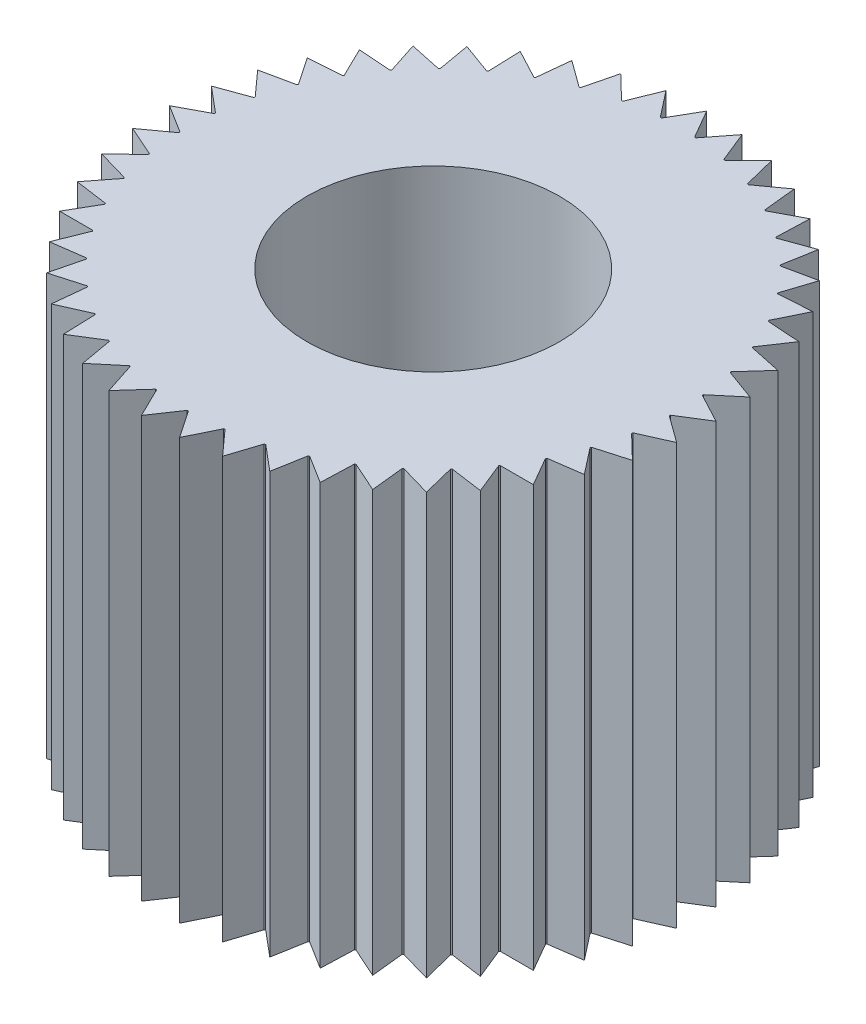
from build123d import *

# Parameters (mm, degrees)
BOSS_EXTRUDE1_DEPTH = 3.81
SKETCH4_R           = 1.143
CUT_EXTRUDE2_DEPTH  = 2.286
SKETCH5_R           = 0.635
CUT_EXTRUDE3_DEPTH  = 1.27
SCALE1_SCALE        = 1.5


with BuildPart() as part:
    # Sketch2 → Boss-Extrude1 (new body)
    with BuildSketch(Plane(origin=(0, 0, 0), x_dir=(1, 0, 0), z_dir=(0, 1, 0))):
        with BuildLine():
            Line((0.344662185, 2.452398872), (0.160511142, 2.216696286))
            ThreePointArc((0.160511142, 2.216696286), (0.155033763, 2.217086102), (0.149555438, 2.217462383))
            Line((0.149555438, 2.217462383), (0, 2.4765))
            Line((0, 2.4765), (-0.149555438, 2.217462383))
            ThreePointArc((-0.149555438, 2.217462383), (-0.155033763, 2.217086102), (-0.160511142, 2.216696286))
            Line((-0.160511142, 2.216696286), (-0.344662185, 2.452398872))
            Line((-0.344662185, 2.452398872), (-0.456711091, 2.175068098))
            ThreePointArc((-0.456711091, 2.175068098), (-0.462083733, 2.173933043), (-0.467453554, 2.172784717))
            Line((-0.467453554, 2.172784717), (-0.682615912, 2.38056459))
            Line((-0.682615912, 2.38056459), (-0.754977382, 2.090338586))
            ThreePointArc((-0.754977382, 2.090338586), (-0.760139769, 2.08846685), (-0.765297515, 2.086582364))
            Line((-0.765297515, 2.086582364), (-1.007283297, 2.262395326))
            Line((-1.007283297, 2.262395326), (-1.038548897, 1.964923011))
            ThreePointArc((-1.038548897, 1.964923011), (-1.043400548, 1.962351025), (-1.04824583, 1.95976706))
            Line((-1.04824583, 1.95976706), (-1.312345058, 2.10019111))
            Line((-1.312345058, 2.10019111), (-1.301906239, 1.801262445))
            ThreePointArc((-1.301906239, 1.801262445), (-1.306352723, 1.79804027), (-1.310791233, 1.794807119))
            Line((-1.310791233, 1.794807119), (-1.591863515, 1.897109063))
            Line((-1.591863515, 1.897109063), (-1.539923457, 1.602542354))
            ThreePointArc((-1.539923457, 1.602542354), (-1.543878228, 1.598732706), (-1.547823575, 1.594913299))
            Line((-1.547823575, 1.594913299), (-1.84039816, 1.657101947))
            Line((-1.84039816, 1.657101947), (-1.747967817, 1.372630599))
            ThreePointArc((-1.747967817, 1.372630599), (-1.7513539, 1.368307629), (-1.754729292, 1.363976306))
            Line((-1.754729292, 1.363976306), (-2.053111548, 1.384841225))
            Line((-2.053111548, 1.384841225), (-1.921989971, 1.116002151))
            ThreePointArc((-1.921989971, 1.116002151), (-1.92474146, 1.11125), (-1.927481199, 1.106491065))
            Line((-1.927481199, 1.106491065), (-2.225863456, 1.085626145))
            Line((-2.225863456, 1.085626145), (-2.058602777, 0.837651991))
            ThreePointArc((-2.058602777, 0.837651991), (-2.060666117, 0.832563154), (-2.062716877, 0.827469234))
            Line((-2.062716877, 0.827469234), (-2.355291463, 0.765280587))
            Line((-2.355291463, 0.765280587), (-2.155147221, 0.542997887))
            ThreePointArc((-2.155147221, 0.542997887), (-2.156482252, 0.537671413), (-2.157804118, 0.532341657))
            Line((-2.157804118, 0.532341657), (-2.4388764, 0.430039712))
            Line((-2.4388764, 0.430039712), (-2.209744176, 0.237774947))
            ThreePointArc((-2.209744176, 0.237774947), (-2.210324912, 0.23231451), (-2.210892156, 0.226852654))
            Line((-2.210892156, 0.226852654), (-2.474991383, 0.086428604))
            Line((-2.474991383, 0.086428604), (-2.221330975, -0.072076012))
            ThreePointArc((-2.221330975, -0.072076012), (-2.221146113, -0.077564131), (-2.220947692, -0.083051778))
            Line((-2.220947692, -0.083051778), (-2.462933474, -0.258864739))
            Line((-2.462933474, -0.258864739), (-2.189682092, -0.380524093))
            ThreePointArc((-2.189682092, -0.380524093), (-2.188735231, -0.385933075), (-2.187775009, -0.391339701))
            Line((-2.187775009, -0.391339701), (-2.402937366, -0.599119574))
            Line((-2.402937366, -0.599119574), (-2.115413539, -0.681565705))
            ThreePointArc((-2.115413539, -0.681565705), (-2.113723107, -0.68679027), (-2.112019773, -0.692010642))
            Line((-2.112019773, -0.692010642), (-2.296170816, -0.927713229))
            Line((-2.296170816, -0.927713229), (-1.999970867, -0.969341417))
            ThreePointArc((-1.999970867, -0.969341417), (-1.997569768, -0.974279874), (-1.995156475, -0.979212383))
            Line((-1.995156475, -0.979212383), (-2.144711912, -1.23825))
            Line((-2.144711912, -1.23825), (-1.845601037, -1.23825))
            ThreePointArc((-1.845601037, -1.23825), (-1.842536005, -1.242806228), (-1.839459725, -1.247354869))
            Line((-1.839459725, -1.247354869), (-1.951508631, -1.524685644))
            Line((-1.951508631, -1.524685644), (-1.655308682, -1.483057456))
            ThreePointArc((-1.655308682, -1.483057456), (-1.651639375, -1.487142773), (-1.647959984, -1.491219011))
            Line((-1.647959984, -1.491219011), (-1.720321454, -1.781445016))
            Line((-1.720321454, -1.781445016), (-1.432797627, -1.698998885))
            ThreePointArc((-1.432797627, -1.698998885), (-1.428595463, -1.702533775), (-1.424384577, -1.706058272))
            Line((-1.424384577, -1.706058272), (-1.455650177, -2.003530587))
            Line((-1.455650177, -2.003530587), (-1.182398796, -1.881871233))
            ThreePointArc((-1.182398796, -1.881871233), (-1.177745565, -1.884786894), (-1.173085144, -1.887691048))
            Line((-1.173085144, -1.887691048), (-1.162646325, -2.186619714))
            Line((-1.162646325, -2.186619714), (-0.908985917, -2.028115099))
            ThreePointArc((-0.908985917, -2.028115099), (-0.903972189, -2.03035478), (-0.898952943, -2.032582066))
            Line((-0.898952943, -2.032582066), (-0.847012885, -2.327148775))
            Line((-0.847012885, -2.327148775), (-0.617880661, -2.134884011))
            ThreePointArc((-0.617880661, -2.134884011), (-0.612604023, -2.136404119), (-0.607323646, -2.137911186))
            Line((-0.607323646, -2.137911186), (-0.514893302, -2.422382533))
            Line((-0.514893302, -2.422382533), (-0.314749061, -2.200099834))
            ThreePointArc((-0.314749061, -2.200099834), (-0.309312217, -2.200870783), (-0.303873485, -2.201628296))
            Line((-0.303873485, -2.201628296), (-0.172751907, -2.47046737))
            Line((-0.172751907, -2.47046737), (-0.005491228, -2.222493216))
            ThreePointArc((-0.005491228, -2.222493216), (0, -2.2225), (0.005491228, -2.222493216))
            Line((0.005491228, -2.222493216), (0.172751907, -2.47046737))
            Line((0.172751907, -2.47046737), (0.303873485, -2.201628296))
            ThreePointArc((0.303873485, -2.201628296), (0.309312217, -2.200870783), (0.314749061, -2.200099834))
            Line((0.314749061, -2.200099834), (0.514893302, -2.422382533))
            Line((0.514893302, -2.422382533), (0.607323646, -2.137911186))
            ThreePointArc((0.607323646, -2.137911186), (0.612604023, -2.136404119), (0.617880661, -2.134884011))
            Line((0.617880661, -2.134884011), (0.847012885, -2.327148775))
            Line((0.847012885, -2.327148775), (0.898952943, -2.032582066))
            ThreePointArc((0.898952943, -2.032582066), (0.903972189, -2.03035478), (0.908985917, -2.028115099))
            Line((0.908985917, -2.028115099), (1.162646325, -2.186619714))
            Line((1.162646325, -2.186619714), (1.173085144, -1.887691048))
            ThreePointArc((1.173085144, -1.887691048), (1.177745565, -1.884786894), (1.182398796, -1.881871233))
            Line((1.182398796, -1.881871233), (1.455650177, -2.003530587))
            Line((1.455650177, -2.003530587), (1.424384577, -1.706058272))
            ThreePointArc((1.424384577, -1.706058272), (1.428595463, -1.702533775), (1.432797627, -1.698998885))
            Line((1.432797627, -1.698998885), (1.720321454, -1.781445016))
            Line((1.720321454, -1.781445016), (1.647959984, -1.491219011))
            ThreePointArc((1.647959984, -1.491219011), (1.651639375, -1.487142773), (1.655308682, -1.483057456))
            Line((1.655308682, -1.483057456), (1.951508631, -1.524685644))
            Line((1.951508631, -1.524685644), (1.839459725, -1.247354869))
            ThreePointArc((1.839459725, -1.247354869), (1.842536005, -1.242806228), (1.845601037, -1.23825))
            Line((1.845601037, -1.23825), (2.144711912, -1.23825))
            Line((2.144711912, -1.23825), (1.995156475, -0.979212383))
            ThreePointArc((1.995156475, -0.979212383), (1.997569768, -0.974279874), (1.999970867, -0.969341417))
            Line((1.999970867, -0.969341417), (2.296170816, -0.927713229))
            Line((2.296170816, -0.927713229), (2.112019773, -0.692010642))
            ThreePointArc((2.112019773, -0.692010642), (2.113723107, -0.68679027), (2.115413539, -0.681565705))
            Line((2.115413539, -0.681565705), (2.402937366, -0.599119574))
            Line((2.402937366, -0.599119574), (2.187775009, -0.391339701))
            ThreePointArc((2.187775009, -0.391339701), (2.188735231, -0.385933075), (2.189682092, -0.380524093))
            Line((2.189682092, -0.380524093), (2.462933474, -0.258864739))
            Line((2.462933474, -0.258864739), (2.220947692, -0.083051778))
            ThreePointArc((2.220947692, -0.083051778), (2.221146113, -0.077564131), (2.221330975, -0.072076012))
            Line((2.221330975, -0.072076012), (2.474991383, 0.086428604))
            Line((2.474991383, 0.086428604), (2.210892156, 0.226852654))
            ThreePointArc((2.210892156, 0.226852654), (2.210324912, 0.23231451), (2.209744176, 0.237774947))
            Line((2.209744176, 0.237774947), (2.4388764, 0.430039712))
            Line((2.4388764, 0.430039712), (2.157804118, 0.532341657))
            ThreePointArc((2.157804118, 0.532341657), (2.156482252, 0.537671413), (2.155147221, 0.542997887))
            Line((2.155147221, 0.542997887), (2.355291463, 0.765280587))
            Line((2.355291463, 0.765280587), (2.062716877, 0.827469234))
            ThreePointArc((2.062716877, 0.827469234), (2.060666117, 0.832563154), (2.058602777, 0.837651991))
            Line((2.058602777, 0.837651991), (2.225863456, 1.085626145))
            Line((2.225863456, 1.085626145), (1.927481199, 1.106491065))
            ThreePointArc((1.927481199, 1.106491065), (1.92474146, 1.11125), (1.921989971, 1.116002151))
            Line((1.921989971, 1.116002151), (2.053111548, 1.384841225))
            Line((2.053111548, 1.384841225), (1.754729292, 1.363976306))
            ThreePointArc((1.754729292, 1.363976306), (1.7513539, 1.368307629), (1.747967817, 1.372630599))
            Line((1.747967817, 1.372630599), (1.84039816, 1.657101947))
            Line((1.84039816, 1.657101947), (1.547823575, 1.594913299))
            ThreePointArc((1.547823575, 1.594913299), (1.543878228, 1.598732706), (1.539923457, 1.602542354))
            Line((1.539923457, 1.602542354), (1.591863515, 1.897109063))
            Line((1.591863515, 1.897109063), (1.310791233, 1.794807119))
            ThreePointArc((1.310791233, 1.794807119), (1.306352723, 1.79804027), (1.301906239, 1.801262445))
            Line((1.301906239, 1.801262445), (1.312345058, 2.10019111))
            Line((1.312345058, 2.10019111), (1.04824583, 1.95976706))
            ThreePointArc((1.04824583, 1.95976706), (1.043400548, 1.962351025), (1.038548897, 1.964923011))
            Line((1.038548897, 1.964923011), (1.007283297, 2.262395326))
            Line((1.007283297, 2.262395326), (0.765297515, 2.086582364))
            ThreePointArc((0.765297515, 2.086582364), (0.760139769, 2.08846685), (0.754977382, 2.090338586))
            Line((0.754977382, 2.090338586), (0.682615912, 2.38056459))
            Line((0.682615912, 2.38056459), (0.467453554, 2.172784717))
            ThreePointArc((0.467453554, 2.172784717), (0.462083733, 2.173933043), (0.456711091, 2.175068098))
            Line((0.456711091, 2.175068098), (0.344662185, 2.452398872))
        make_face()
    extrude(amount=BOSS_EXTRUDE1_DEPTH)

    # Sketch4 → Cut-Extrude2 (cut)
    with BuildSketch(Plane(origin=(0, 3.81, 0), x_dir=(1, 0, 0), z_dir=(0, 1, 0))):
        with Locations(Location((0, 0, 0), (0, 0, 270))):
            Circle(SKETCH4_R)
    extrude(amount=-CUT_EXTRUDE2_DEPTH, mode=Mode.SUBTRACT)

    # Sketch5 → Cut-Extrude3 (cut)
    with BuildSketch(Plane.XZ):
        with Locations(Location((0, 0, 0), (0, 0, 270))):
            Circle(SKETCH5_R)
    extrude(amount=-CUT_EXTRUDE3_DEPTH, mode=Mode.SUBTRACT)


with BuildPart() as part_1:
    # Scale1: scaled about (0, 1.811481146, 0)
    add(part.part.scale(SCALE1_SCALE).moved(Location((0, -0.905740573, 0))))


solid = part_1.part
